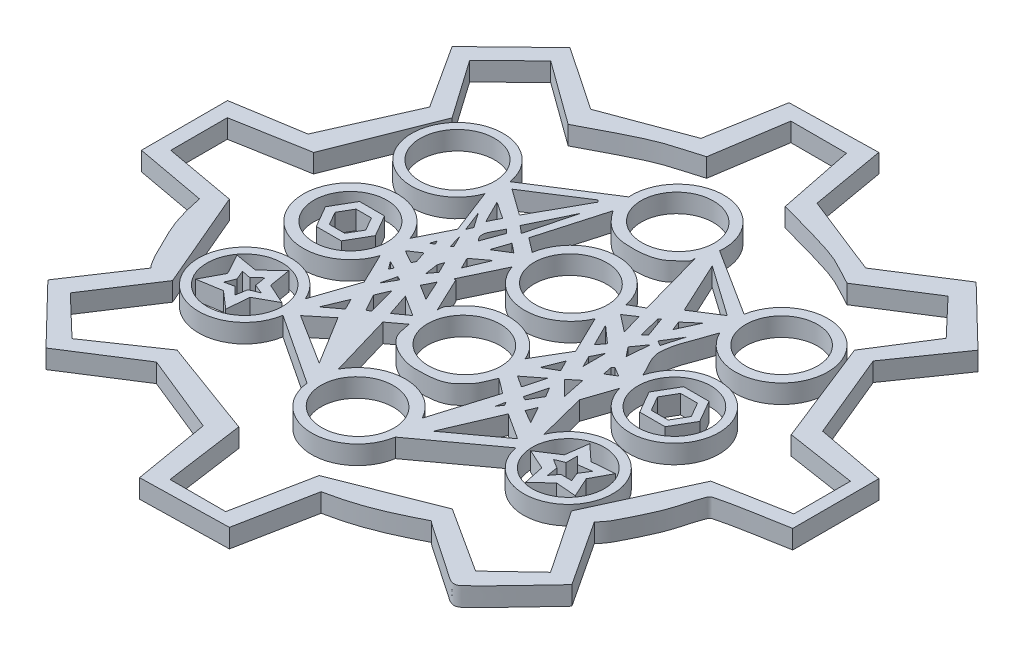
from build123d import *

# Parameters (mm, degrees)
BOSS_EXTRUDE1_DEPTH   = 10
SKETCH3_R             = 20.15333043
SKETCH3_R_2           = 19.23744381
SKETCH3_R_3           = 19.483952443
SKETCH3_R_4           = 19.88227553
SKETCH3_R_5           = 19.42242113
SKETCH3_R_6           = 19.222611357
BOSS_EXTRUDE1_2_DEPTH = 10
BOSS_EXTRUDE1_3_DEPTH = 10
BOSS_EXTRUDE1_4_DEPTH = 10
BOSS_EXTRUDE1_5_DEPTH = 10
BOSS_EXTRUDE1_6_DEPTH = 10


with BuildPart() as part:
    # Sketch3 → Boss-Extrude1 (new body)
    with BuildSketch(Plane(origin=(0, 0, 0), x_dir=(1, 0, 0), z_dir=(0, 1, 0))):
        with BuildLine():
            Line((0, 199), (0, 153))
            Line((0, 153), (38, 146))
            add(Edge.make_bspline(
                [(38, 146), (39.707606721, 137.461966393), (41.955720992, 128.58302314), (46, 121), (47.060130548, 119.012255223), (53.117410924, 104.882589076), (57, 101)],
                knots=[0, 0, 0, 0, 1, 1, 1, 2, 2, 2, 2], degree=3))
            Line((57, 101), (35, 68))
            Line((35, 68), (66, 36))
            Line((66, 36), (102, 59))
            Line((102, 59), (144, 42))
            Line((144, 42), (151, 1))
            Line((151, 1), (198, 2))
            Line((198, 2), (206, 43))
            add(Edge.make_bspline(
                [(206, 43), (223.220068359, 46.444013672), (233.459931929, 51.229965964), (249, 59)],
                knots=[0, 0, 0, 0, 1, 1, 1, 1], degree=3))
            add(Edge.make_bspline(
                [(249, 59), (249.333333333, 58.666666667), (249.612414884, 58.268328157), (250, 58), (257.822886636, 52.584155406), (267.022287775, 46.185512946), (275, 41), (277.636620419, 39.286196728), (280.016713222, 36.994428926), (283, 36), (284.303840481, 35.565386506), (285.998294138, 36.059003584), (287, 37), (297.137132899, 46.522761208), (306.333333333, 57), (316, 67)],
                knots=[0, 0, 0, 0, 1, 1, 1, 2, 2, 2, 3, 3, 3, 4, 4, 4, 5, 5, 5, 5], degree=3))
            Line((316, 67), (293, 102))
            add(Edge.make_bspline(
                [(293, 102), (295.02359172, 104.02359172), (296.762581569, 106.525163138), (298, 109), (300.800793538, 114.601587077), (303.704543169, 120.173071121), (306, 126), (308.048023506, 131.198828901), (309.068307397, 136.756834362), (311, 142), (311.415486132, 143.127748074), (311.837721056, 144.69413712), (313, 145), (324.822241755, 148.111116251), (337, 149.666666667), (349, 152)],
                knots=[0, 0, 0, 0, 1, 1, 1, 2, 2, 2, 3, 3, 3, 4, 4, 4, 5, 5, 5, 5], degree=3))
            Line((349, 152), (349, 198))
            Line((349, 198), (312, 205))
            Line((312, 205), (293, 251))
            Line((293, 251), (316, 284))
            Line((316, 284), (284, 315))
            Line((284, 315), (248, 292))
            Line((248, 292), (205, 309))
            Line((205, 309), (198, 349))
            Line((198, 349), (151, 348))
            Line((151, 348), (144, 308))
            Line((144, 308), (101, 292))
            Line((101, 292), (67, 315))
            Line((67, 315), (35, 284))
            Line((35, 284), (57, 250))
            Line((57, 250), (37, 205))
            Line((37, 205), (0, 199))
        make_face()
        with BuildLine():
            Line((154, 301), (160, 340))
            Line((160, 340), (189.724702472, 340))
            Line((189.724702472, 340), (198, 299))
            add(Edge.make_bspline(
                [(198, 299), (209.333333333, 295.666666667), (220.904122097, 293.05426308), (232, 289), (238.300780655, 286.697791684), (244, 283), (250, 280)],
                knots=[0, 0, 0, 0, 1, 1, 1, 2, 2, 2, 2], degree=3))
            Line((250, 280), (283, 301))
            Line((283, 301), (302, 281))
            Line((302, 281), (283, 251))
            Line((283, 251), (305.208482262, 195))
            Line((305.208482262, 195), (342.571611896, 189.25182621))
            Line((342.571611896, 189.25182621), (342.571611896, 159))
            Line((342.571611896, 159), (305.208482262, 152))
            Line((305.208482262, 152), (281.805171723, 101))
            Line((281.805171723, 101), (304.593329063, 67))
            Line((304.593329063, 67), (284, 47.544168765))
            Line((284, 47.544168765), (249, 70.077394925))
            Line((249, 70.077394925), (198, 49.916087308))
            Line((198, 49.916087308), (189.724702472, 8.285032946))
            Line((189.724702472, 8.285032946), (160, 8.285032946))
            Line((160, 8.285032946), (154, 51))
            Line((154, 51), (102, 70.077394925))
            Line((102, 70.077394925), (68.621520735, 47.276140876))
            Line((68.621520735, 47.276140876), (47, 68))
            Line((47, 68), (68.621520735, 101))
            Line((68.621520735, 101), (46.113419655, 153.854267328))
            Line((46.113419655, 153.854267328), (7.867619739, 160.807212736))
            Line((7.867619739, 160.807212736), (7.867619739, 191))
            Line((7.867619739, 191), (47, 198))
            Line((47, 198), (68, 251))
            Line((68, 251), (46.113419655, 282.241135609))
            Line((46.113419655, 282.241135609), (68, 303.690705301))
            Line((68, 303.690705301), (102, 279))
            add(Edge.make_bspline(
                [(102, 279), (112, 284), (121.703273108, 289.643692469), (132, 294), (139.087393355, 296.998512573), (146.666666667, 298.666666667), (154, 301)],
                knots=[0, 0, 0, 0, 1, 1, 1, 2, 2, 2, 2], degree=3))
        make_face(mode=Mode.SUBTRACT)
    extrude(amount=BOSS_EXTRUDE1_DEPTH)


with BuildPart() as body_2:
    # Sketch3 → Boss-Extrude1 2 (new body)
    with BuildSketch(Plane(origin=(0, 0, 0), x_dir=(1, 0, 0), z_dir=(0, 1, 0))):
        with BuildLine():
            ThreePointArc((237.707995647, 115.275121129), (284.781171221, 117.767620009), (238.999951577, 129.000444106))
            Line((238.999951577, 129.000444106), (232.502301083, 154.60582101))
            Line((232.502301083, 154.60582101), (237.929703258, 170.674359653))
            ThreePointArc((237.929703258, 170.674359653), (284.96407318, 176.569545692), (237.999951577, 183.000444106))
            add(Edge.make_bspline(
                [(237.999951577, 183.000444106), (235.962113739, 188.027471133), (231.750871185, 192.658850071), (231.886438063, 198.081525187), (232.102323696, 206.716950513), (236.628780406, 214.694137799), (238.999951577, 223.000444106)],
                knots=[0, 0, 0, 0, 1, 1, 1, 2, 2, 2, 2], degree=3))
            ThreePointArc((238.999951577, 223.000444106), (285.741392904, 237.231434121), (236.889726658, 238.12480929))
            Line((236.889726658, 238.12480929), (200.999951577, 260.945156041))
            ThreePointArc((200.999951577, 260.945156041), (176.724582831, 287.859906098), (151.751813714, 261.590949114))
            Line((151.751813714, 261.590949114), (112.999951577, 236.93094092))
            ThreePointArc((112.999951577, 236.93094092), (64.482041892, 235.280675184), (111.851214944, 224.656533734))
            Line((111.851214944, 224.656533734), (120.999951577, 201.000444106))
            Line((120.999951577, 201.000444106), (112.524643631, 184))
            ThreePointArc((112.524643631, 184), (63.477264255, 176), (112.524643631, 168))
            Line((112.524643631, 168), (120.473068783, 151.532359051))
            Line((120.473068783, 151.532359051), (112.524643631, 128))
            ThreePointArc((112.524643631, 128), (65.309698115, 115.387158675), (114.171026343, 114.435607221))
            Line((114.171026343, 114.435607221), (152, 89.462295462))
            ThreePointArc((152, 89.462295462), (175.682749027, 67.62007257), (200.542767904, 88.11238244))
            Line((200.542767904, 88.11238244), (237.707995647, 115.275121129))
        make_face()
        with Locations((89.807533952, 118.360591696)):
            Circle(SKETCH3_R, mode=Mode.SUBTRACT)
        Polygon((119, 119), (130, 128), (146, 102), align=None, mode=Mode.SUBTRACT)
        Polygon((120, 128), (125, 140), (128, 134), align=None, mode=Mode.SUBTRACT)
        Polygon((125, 155), (127, 163), (129, 162), align=None, mode=Mode.SUBTRACT)
        Polygon((121, 164), (118, 168), (122, 166), align=None, mode=Mode.SUBTRACT)
        Polygon((129, 148), (132, 155), (136, 140), (134, 139), align=None, mode=Mode.SUBTRACT)
        Polygon((142, 144), (138, 156), (149, 149), align=None, mode=Mode.SUBTRACT)
        Polygon((137, 165), (140, 171), (145, 160), align=None, mode=Mode.SUBTRACT)
        with BuildLine():
            add(Edge.make_bspline(
                [(195.635080889, 88.199423025), (202.29497902, 120.943056704), (170.058461035, 110.450697417), (137.821943049, 99.958338131), (163.398562903, 77.707063738), (188.975182757, 55.455789346), (195.635080889, 88.199423025)],
                knots=[0, 0, 0, 2.094395102, 2.094395102, 4.188790205, 4.188790205, 6.283185307, 6.283185307, 6.283185307], degree=2, weights=[1, 0.5, 1, 0.5, 1, 0.5, 1]))
        make_face(mode=Mode.SUBTRACT)
        with BuildLine():
            add(Edge.make_bspline(
                [(152, 144), (152.666666667, 141.333333333), (152.862564502, 138.502358096), (154, 136), (156.927715007, 129.559026985), (167.548806493, 125), (174, 125), (179.380837991, 125), (187.322285282, 124.790056754), (192, 129), (198.22844791, 134.605603119), (197.965411774, 135.919294139), (201, 143)],
                knots=[0, 0, 0, 0, 1, 1, 1, 2, 2, 2, 3, 3, 3, 4, 4, 4, 4], degree=3))
            Line((201, 143), (209, 137))
            Line((209, 137), (199, 104))
            ThreePointArc((199, 104), (176.550135437, 117.682883152), (153.903442453, 104.328295658))
            Line((153.903442453, 104.328295658), (144, 138))
            Line((144, 138), (152, 144))
        make_face(mode=Mode.SUBTRACT)
        Polygon((213, 129), (214, 134), (215, 132), align=None, mode=Mode.SUBTRACT)
        Polygon((208, 101), (220, 129), (234, 120), align=None, mode=Mode.SUBTRACT)
        with Locations((261.060368394, 120.000444106)):
            Circle(SKETCH3_R_2, mode=Mode.SUBTRACT)
        with BuildLine():
            add(Edge.make_bspline(
                [(195.944745219, 147.948087), (198.052243763, 181.180338786), (167.601621103, 166.428482226), (137.150998443, 151.676625666), (165.494122559, 133.19623044), (193.837246674, 114.715835214), (195.944745219, 147.948087)],
                knots=[0, 0, 0, 2.094395102, 2.094395102, 4.188790205, 4.188790205, 6.283185307, 6.283185307, 6.283185307], degree=2, weights=[1, 0.5, 1, 0.5, 1, 0.5, 1]))
        make_face(mode=Mode.SUBTRACT)
        Polygon((205, 149), (214, 156), (211, 145), align=None, mode=Mode.SUBTRACT)
        Polygon((207, 159), (211, 169), (214, 163), align=None, mode=Mode.SUBTRACT)
        Polygon((223, 135), (225, 140), (230, 131), align=None, mode=Mode.SUBTRACT)
        Polygon((216, 141), (219, 152), (222, 147), (218, 140), align=None, mode=Mode.SUBTRACT)
        Polygon((227, 152), (218.999982727, 160.000021126), (224.409744373, 164.423073021), align=None, mode=Mode.SUBTRACT)
        with Locations((88.653384316, 176)):
            Circle(SKETCH3_R_3, mode=Mode.SUBTRACT)
        Polygon((117, 177), (123, 181), (125, 175), (124, 173), align=None, mode=Mode.SUBTRACT)
        Polygon((120, 187), (121, 190), (122, 188), align=None, mode=Mode.SUBTRACT)
        Polygon((127, 191), (125, 198), (128, 192), align=None, mode=Mode.SUBTRACT)
        Polygon((123.254130946, 203), (119, 214), (124.566018504, 206.061070967), align=None, mode=Mode.SUBTRACT)
        Polygon((125, 212), (119, 224), (128, 218), align=None, mode=Mode.SUBTRACT)
        Polygon((132, 179), (133, 182), (136, 176), (133, 172), align=None, mode=Mode.SUBTRACT)
        Polygon((137, 190), (145, 196), (140, 184), align=None, mode=Mode.SUBTRACT)
        with BuildLine():
            add(Edge.make_bspline(
                [(132, 201), (127.689238112, 205.310761888), (131.682913069, 208.786554406), (134, 214)],
                knots=[0, 0, 0, 0, 1, 1, 1, 1], degree=3))
            Line((134, 214), (136, 212))
            Line((136, 212), (132, 201))
        make_face(mode=Mode.SUBTRACT)
        Polygon((139, 200), (142, 209), (147, 205), align=None, mode=Mode.SUBTRACT)
        with Locations((88.846621147, 233.000444106)):
            Circle(SKETCH3_R_4, mode=Mode.SUBTRACT)
        Polygon((136, 219.314407265), (146.446930695, 240.936909765), (140, 216), align=None, mode=Mode.SUBTRACT)
        Polygon((117, 234), (145, 252), (146, 251), (131, 224), align=None, mode=Mode.SUBTRACT)
        with BuildLine():
            add(Edge.make_bspline(
                [(199, 159), (192.879017143, 174.302457143), (169.767391621, 179.837154496), (158, 167), (152.823333687, 161.352727658), (153, 161.865309198), (153, 158)],
                knots=[0, 0, 0, 0, 1, 1, 1, 2, 2, 2, 2], degree=3))
            Line((153, 158), (144, 177))
            Line((144, 177), (143, 177))
            Line((143, 177), (153, 198))
            ThreePointArc((153, 198), (175.491688004, 181.316374298), (199.161719965, 196.281299382))
            Line((199.161719965, 196.281299382), (209, 176))
            Line((209, 176), (199, 159))
        make_face(mode=Mode.SUBTRACT)
        Polygon((215, 177), (218, 183), (218, 171), align=None, mode=Mode.SUBTRACT)
        Polygon((211, 184), (205, 196), (214, 188), align=None, mode=Mode.SUBTRACT)
        with BuildLine():
            add(Edge.make_bspline(
                [(196.039549222, 205.354154063), (197.238871968, 238.651678727), (167.199366586, 223.063291751), (137.159861203, 207.474904775), (166.000043839, 189.765767087), (194.840226476, 172.056629399), (196.039549222, 205.354154063)],
                knots=[0, 0, 0, 2.094395102, 2.094395102, 4.188790205, 4.188790205, 6.283185307, 6.283185307, 6.283185307], degree=2, weights=[1, 0.5, 1, 0.5, 1, 0.5, 1]))
        make_face(mode=Mode.SUBTRACT)
        Polygon((204, 205), (210, 209), (213, 198), align=None, mode=Mode.SUBTRACT)
        Polygon((226, 178), (227, 179), (232, 176), (227, 173), align=None, mode=Mode.SUBTRACT)
        Polygon((221, 192), (226, 199), (225, 187), align=None, mode=Mode.SUBTRACT)
        with Locations((261.060368394, 176.705776713)):
            Circle(SKETCH3_R_5, mode=Mode.SUBTRACT)
        Polygon((216, 213), (217, 214), (221, 203), (219, 201), align=None, mode=Mode.SUBTRACT)
        Polygon((226.259104095, 202.790257729), (232, 212), (228.886239145, 201.152632223), align=None, mode=Mode.SUBTRACT)
        Polygon((223, 217), (230, 223), (225, 212), align=None, mode=Mode.SUBTRACT)
        with BuildLine():
            add(Edge.make_bspline(
                [(154, 251), (158.17388137, 244.739177946), (163.792921462, 239.683923212), (172, 239), (177.202201816, 238.566483182), (187.012039211, 238.51083529), (192, 243), (198.216930458, 248.595237412), (198, 247.10663739), (198, 251)],
                knots=[0, 0, 0, 0, 1, 1, 1, 2, 2, 2, 3, 3, 3, 3], degree=3))
            Line((198, 251), (208, 215))
            Line((208, 215), (201, 211))
            ThreePointArc((201, 211), (175.9739994, 231.135391311), (151.66815782, 210.136325753))
            Line((151.66815782, 210.136325753), (144, 216))
            Line((144, 216), (154, 251))
        make_face(mode=Mode.SUBTRACT)
        Polygon((219, 224), (206, 252), (233, 233), align=None, mode=Mode.SUBTRACT)
        with Locations((261.24488663, 233.81356254)):
            Circle(SKETCH3_R_6, mode=Mode.SUBTRACT)
        with BuildLine():
            add(Edge.make_bspline(
                [(195.889054371, 260.945156041), (199.649663571, 293.989404957), (168.536874763, 280.794090841), (137.424085954, 267.598776726), (164.776265563, 247.749841925), (192.128445171, 227.900907124), (195.889054371, 260.945156041)],
                knots=[0, 0, 0, 2.094395102, 2.094395102, 4.188790205, 4.188790205, 6.283185307, 6.283185307, 6.283185307], degree=2, weights=[1, 0.5, 1, 0.5, 1, 0.5, 1]))
        make_face(mode=Mode.SUBTRACT)
    extrude(amount=BOSS_EXTRUDE1_2_DEPTH)


with BuildPart() as body_3:
    # Sketch3 → Boss-Extrude1 3 (new body)
    with BuildSketch(Plane(origin=(0, 0, 0), x_dir=(1, 0, 0), z_dir=(0, 1, 0))):
        Polygon((95.326692158, 164.441491763), (102, 176), (95.326692158, 187.558508237), (81.980076473, 187.558508237), (75.306768631, 176), (81.980076473, 164.441491763), align=None)
        Polygon((92.761051356, 183.114688015), (96.868718397, 176), (92.761051356, 168.885311985), (84.545717275, 168.885311985), (80.438050234, 176), (84.545717275, 183.114688015), align=None, mode=Mode.SUBTRACT)
    extrude(amount=BOSS_EXTRUDE1_3_DEPTH)


with BuildPart() as body_4:
    # Sketch3 → Boss-Extrude1 4 (new body)
    with BuildSketch(Plane(origin=(0, 0, 0), x_dir=(1, 0, 0), z_dir=(0, 1, 0))):
        Polygon((267.840809651, 164.961707958), (274.621250908, 176.705776713), (267.840809651, 188.449845467), (254.279927138, 188.449845467), (247.499485881, 176.705776713), (254.279927138, 164.961707958), align=None)
        Polygon((265.580421164, 184.534737763), (270.100473934, 176.705776713), (265.580421164, 168.876815662), (256.540315624, 168.876815662), (252.020262855, 176.705776713), (256.540315624, 184.534737763), align=None, mode=Mode.SUBTRACT)
    extrude(amount=BOSS_EXTRUDE1_4_DEPTH)


with BuildPart() as body_5:
    # Sketch3 → Boss-Extrude1 5 (new body)
    with BuildSketch(Plane(origin=(0, 0, 0), x_dir=(1, 0, 0), z_dir=(0, 1, 0))):
        Polygon((86.007803884, 128), (74.079849968, 130.004283707), (80.043826926, 119), (74.079849968, 107.815160143), (86.878723388, 109.948305713), (96.046227865, 102), (97.037720949, 113.969588177), (107.955142126, 120.027769499), (97.037720949, 124.992130685), (95.05473478, 136.890047701), align=None)
        Polygon((85.070160305, 119), (83.001022094, 124.002089662), (87.927654804, 122.988476234), (92.005680922, 126.995785136), (92.995721945, 121.055538999), (97.99307187, 119), (92.995721945, 116.915569241), (92.005680922, 111.023607112), (88.04353781, 115.055670397), (83.001022094, 113.969588177), align=None, mode=Mode.SUBTRACT)
    extrude(amount=BOSS_EXTRUDE1_5_DEPTH)


with BuildPart() as body_6:
    # Sketch3 → Boss-Extrude1 6 (new body)
    with BuildSketch(Plane(origin=(0, 0, 0), x_dir=(1, 0, 0), z_dir=(0, 1, 0))):
        Polygon((255.570461806, 137), (253.91593461, 124.992931341), (243.011319875, 117.95778462), (253.91593461, 112.99924677), (256.285007316, 102), (264.935252866, 109.948305713), (275.755011602, 109.052058005), (270.844513456, 119.824536232), (276.272555356, 130.004283707), (264.212372037, 129.000444106), align=None)
        Polygon((257.97031158, 121.985862681), (257.97031158, 128), (262.029696081, 124.025662067), (269.100495607, 124.992931341), (265.868145587, 119.824536232), (267.840809651, 115.055670397), (262.029696081, 115.055670397), (258.966156868, 111.023607112), (257.97031158, 116.998678838), (253.170612033, 120.000444106), align=None, mode=Mode.SUBTRACT)
    extrude(amount=BOSS_EXTRUDE1_6_DEPTH)


solid = Compound([part.part, body_2.part, body_3.part, body_4.part, body_5.part, body_6.part])
